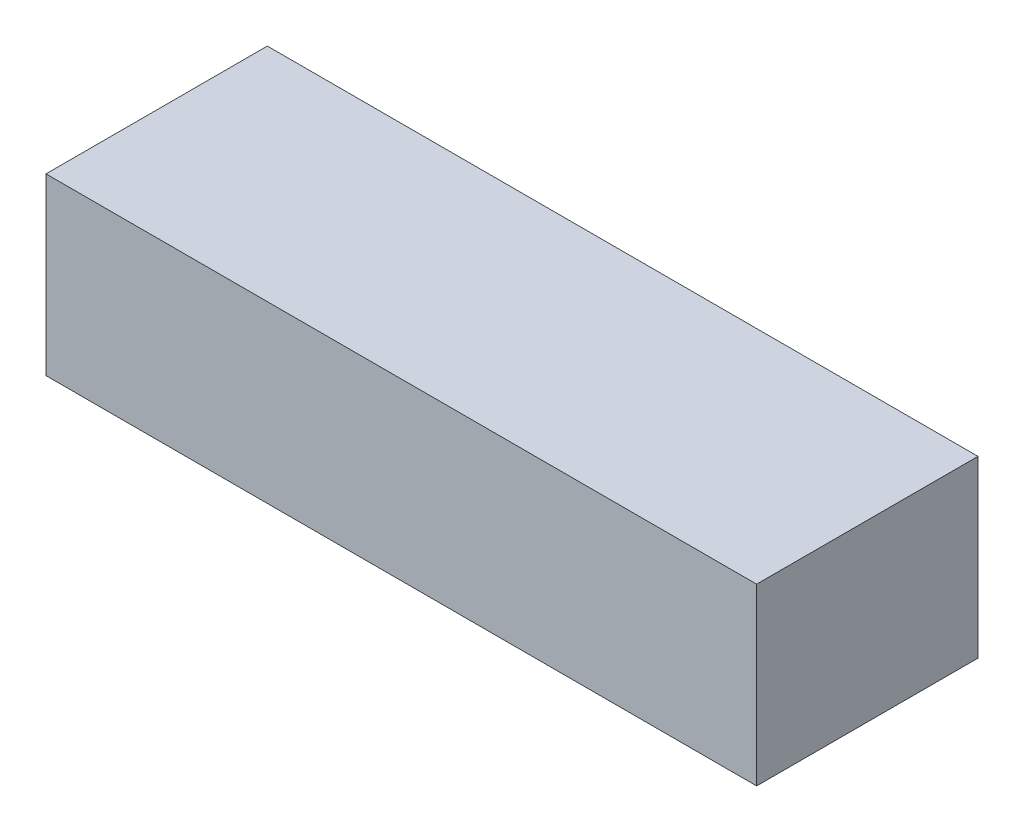
from build123d import *

# Parameters (mm, degrees)
SKETCH1_W           = 19
SKETCH1_H           = 15
BOSS_EXTRUDE1_DEPTH = 61


with BuildPart() as part:
    # Sketch1 → Boss-Extrude1 (new body)
    with BuildSketch(Plane(origin=(0, 0, 0), x_dir=(0, 0, -1), z_dir=(1, 0, 0))):
        Rectangle(SKETCH1_W, SKETCH1_H)
    extrude(amount=BOSS_EXTRUDE1_DEPTH)


solid = part.part
